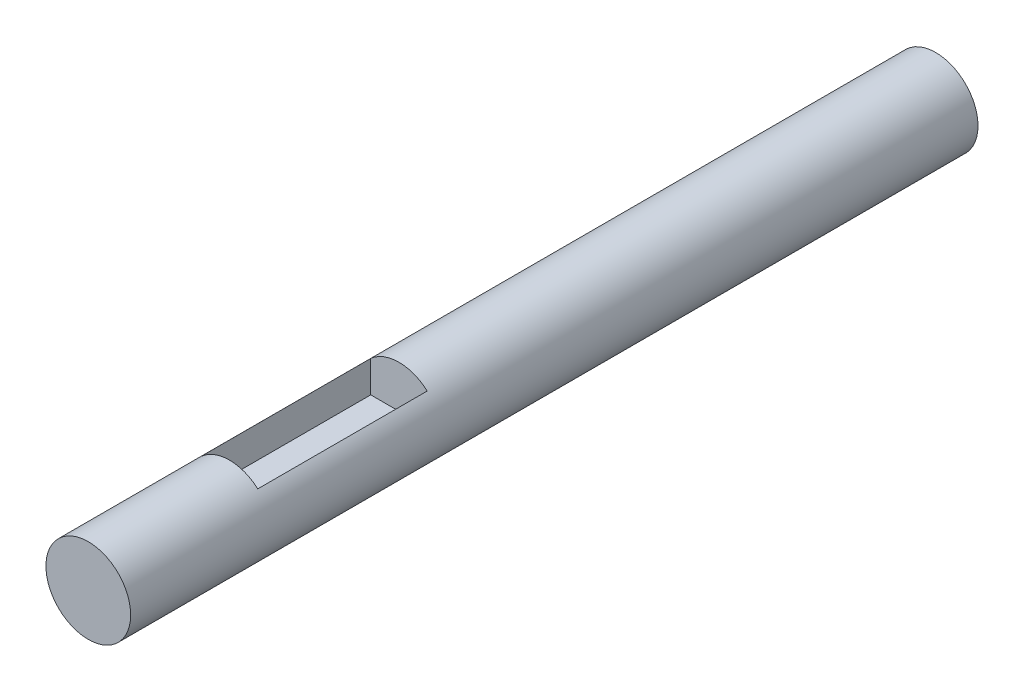
from build123d import *

# Parameters (mm, degrees)
SKETCH1_R           = 3
BOSS_EXTRUDE1_DEPTH = 60
SKETCH2_W           = 4
SKETCH2_H           = 12
CUT_EXTRUDE1_DEPTH  = 3


with BuildPart() as part:
    # Sketch1 → Boss-Extrude1 (new body)
    with BuildSketch(Plane.XY):
        Circle(SKETCH1_R)
    extrude(amount=BOSS_EXTRUDE1_DEPTH)

    # Sketch2 → Cut-Extrude1 (cut)
    with BuildSketch(Plane(origin=(0, 3, 0), x_dir=(1, 0, 0), z_dir=(0, 1, 0))):
        with Locations((0, -44)):
            Rectangle(SKETCH2_W, SKETCH2_H)
    extrude(amount=-CUT_EXTRUDE1_DEPTH, mode=Mode.SUBTRACT)


solid = part.part
